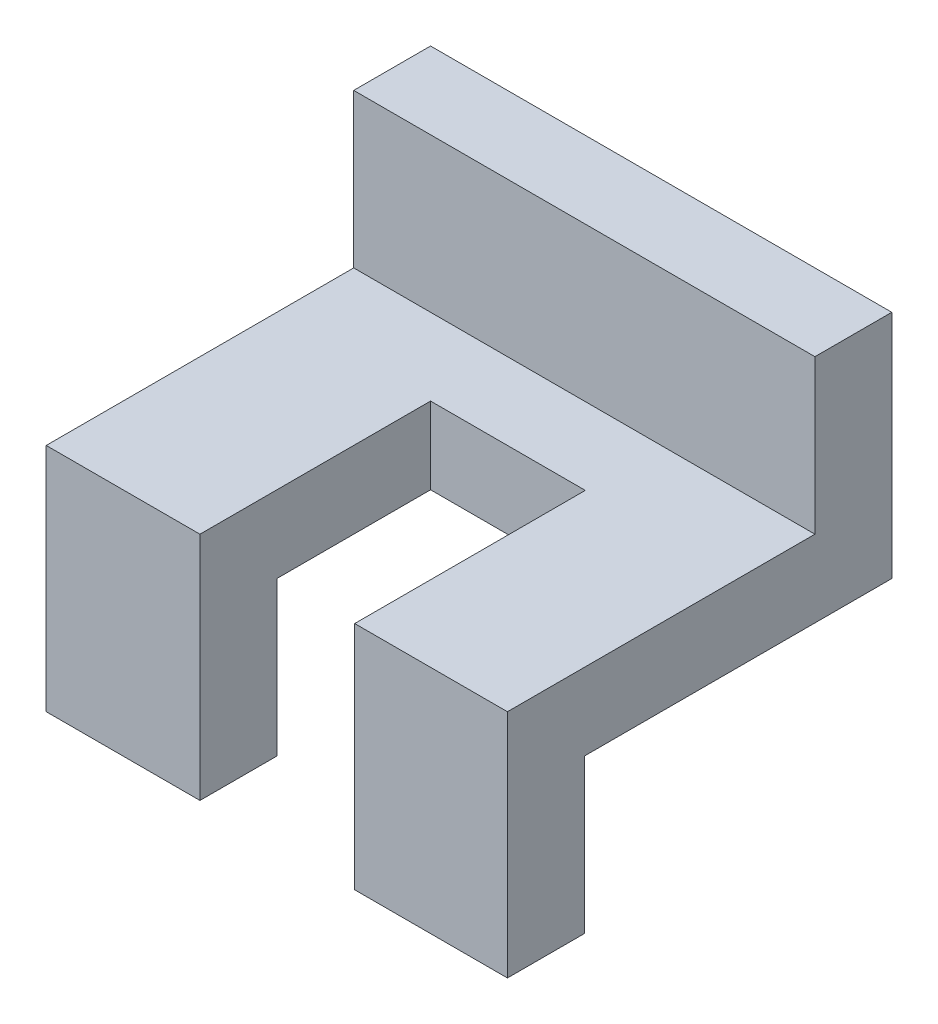
from build123d import *

# Parameters (mm, degrees)
BOSS_EXTRUDE1_DEPTH = 38.1
SKETCH2_W           = 12.782689939
SKETCH2_H           = 19.05
CUT_EXTRUDE1_DEPTH  = 46.459081876


with BuildPart() as part:
    # Sketch1 → Boss-Extrude1 (new body)
    with BuildSketch(Plane(origin=(0, 0, 0), x_dir=(0, 0, -1), z_dir=(1, 0, 0))):
        Polygon((-9.525, -3.175), (-9.525, -15.875), (-15.875, -15.875), (-15.875, 3.175), (9.525, 3.175), (9.525, 15.875), (15.875, 15.875), (15.875, -3.175), align=None)
    extrude(amount=BOSS_EXTRUDE1_DEPTH)

    # Sketch2 → Cut-Extrude1 (cut, through all)
    with BuildSketch(Plane(origin=(0, 3.175, 0), x_dir=(1, 0, 0), z_dir=(0, 1, 0))):
        with Locations((19.091344969, -6.35)):
            Rectangle(SKETCH2_W, SKETCH2_H)
    extrude(amount=-CUT_EXTRUDE1_DEPTH, mode=Mode.SUBTRACT)


solid = part.part
